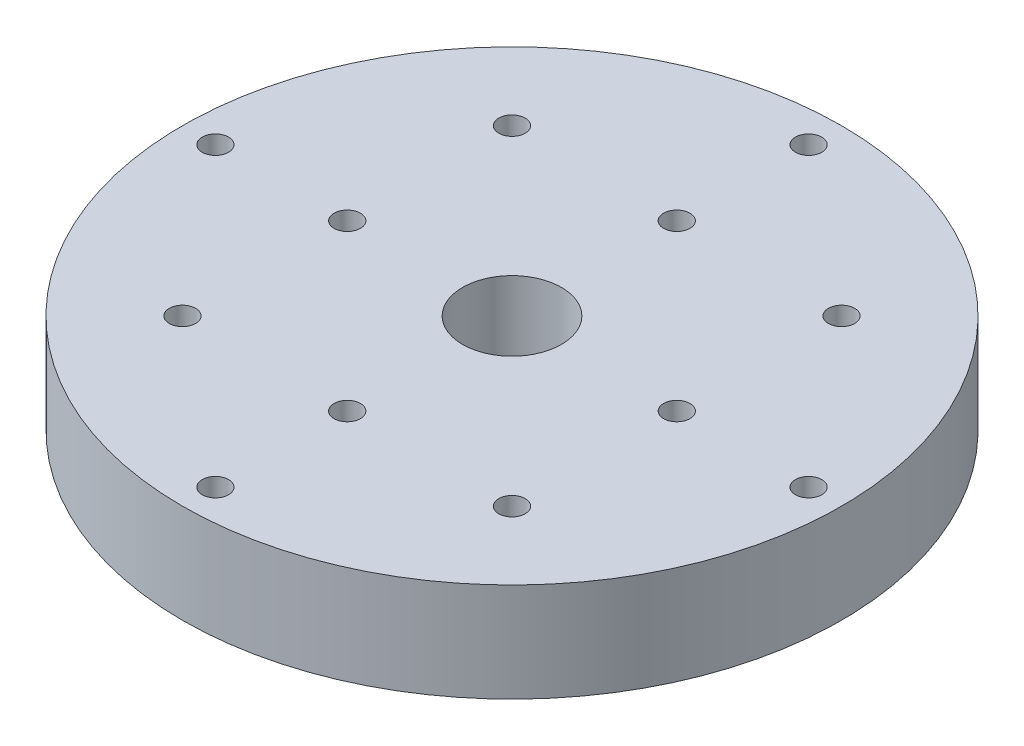
from build123d import *

# Parameters (mm, degrees)
SKETCH1_R           = 50
BOSS_EXTRUDE1_DEPTH = 15
SKETCH2_R           = 7.5
SKETCH2_R_2         = 2
CUT_EXTRUDE1_DEPTH  = 73.284161474


with BuildPart() as part:
    # Sketch1 → Boss-Extrude1 (new body)
    with BuildSketch(Plane(origin=(0, 0, 0), x_dir=(1, 0, 0), z_dir=(0, 1, 0))):
        with Locations(Location((0, 0, 0), (0, 0, 270))):
            Circle(SKETCH1_R)
    extrude(amount=BOSS_EXTRUDE1_DEPTH)

    # Sketch2 → Cut-Extrude1 (cut, through all)
    with BuildSketch(Plane(origin=(0, 15, 0), x_dir=(1, 0, 0), z_dir=(0, 1, 0))):
        with Locations(Location((0, 0, 0), (0, 0, 270))):
            Circle(SKETCH2_R)
        with Locations(Location((45, 0, 0), (0, 0, 270))):
            Circle(SKETCH2_R_2)
        with Locations(Location((0, -45, 0), (0, 0, 270))):
            Circle(SKETCH2_R_2)
        with Locations(Location((0, -25, 0), (0, 0, 270))):
            Circle(SKETCH2_R_2)
        with Locations(Location((25, -25, 0), (0, 0, 270))):
            Circle(SKETCH2_R_2)
        with Locations(Location((-25, -25, 0), (0, 0, 270))):
            Circle(SKETCH2_R_2)
        with Locations(Location((-25, 0, 0), (0, 0, 270))):
            Circle(SKETCH2_R_2)
        with Locations(Location((-45, 0, 0), (0, 0, 270))):
            Circle(SKETCH2_R_2)
        with Locations(Location((-25, 25, 0), (0, 0, 270))):
            Circle(SKETCH2_R_2)
        with Locations(Location((0, 45, 0), (0, 0, 270))):
            Circle(SKETCH2_R_2)
        with Locations(Location((0, 25, 0), (0, 0, 270))):
            Circle(SKETCH2_R_2)
        with Locations(Location((25, 25, 0), (0, 0, 270))):
            Circle(SKETCH2_R_2)
        with Locations(Location((25, 0, 0), (0, 0, 270))):
            Circle(SKETCH2_R_2)
    extrude(amount=-CUT_EXTRUDE1_DEPTH, mode=Mode.SUBTRACT)


solid = part.part
